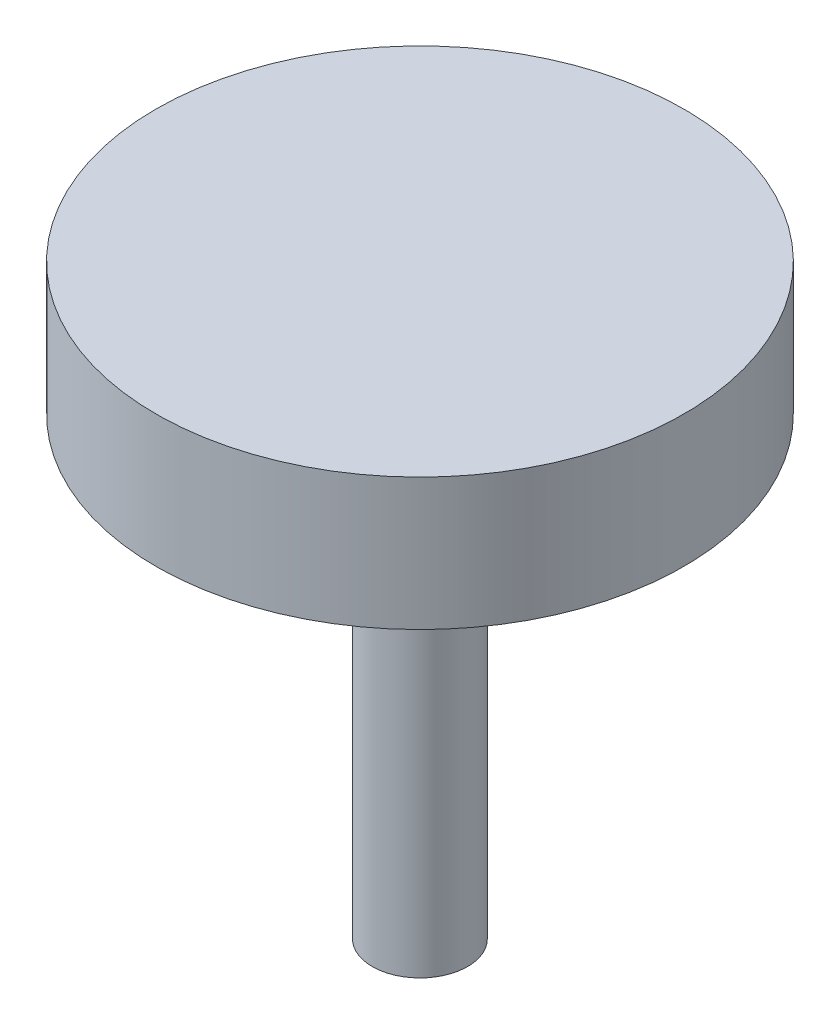
from build123d import *

# Parameters (mm, degrees)
SKETCH1_W = 0.65
SKETCH1_H = 8
SKETCH2_W = 3.6
SKETCH2_H = 1.8


with BuildPart() as part:
    # Sketch1 → Revolve1 (revolve)
    with BuildSketch(Plane.XY, mode=Mode.PRIVATE) as revolve1_sk:
        with Locations((0.325, 4)):
            Rectangle(SKETCH1_W, SKETCH1_H)
    revolve(revolve1_sk.sketch.rotate(Axis((0, 8, 0), (0, -1, 0)), 180), axis=Axis((0, 8, 0), (0, -1, 0)))

    # Sketch2 → Revolve2 (revolve)
    with BuildSketch(Plane.XY, mode=Mode.PRIVATE) as revolve2_sk:
        with Locations((1.8, 7.1)):
            Rectangle(SKETCH2_W, SKETCH2_H)
    revolve(revolve2_sk.sketch.rotate(Axis((0, 8, 0), (0, -1, 0)), 180), axis=Axis((0, 8, 0), (0, -1, 0)))


solid = part.part
